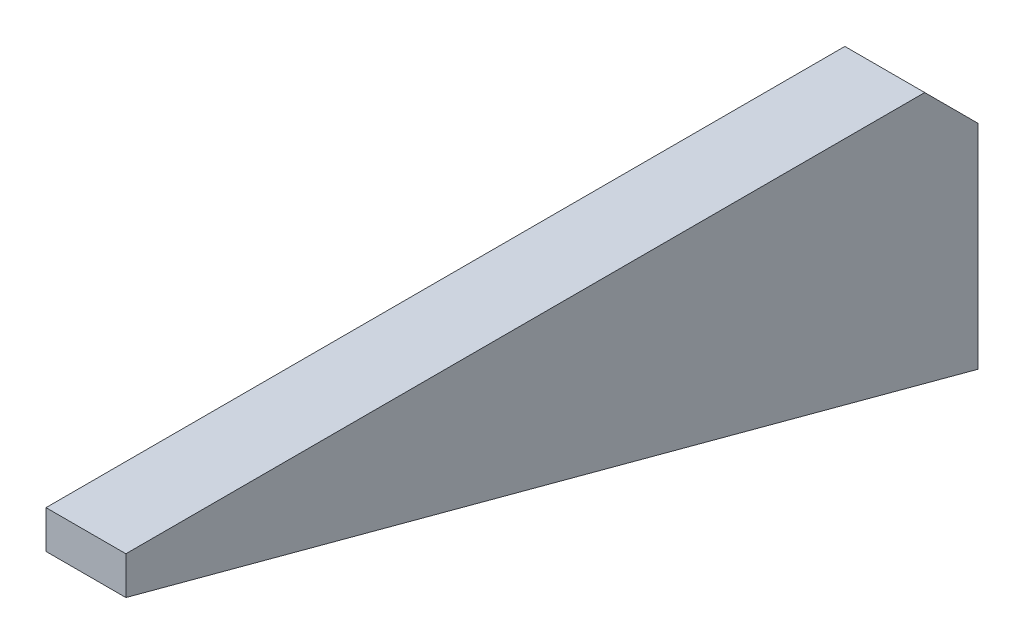
from build123d import *

# Parameters (mm, degrees)
BOSS_EXTRUDE1_DEPTH = 7.5
CHAMFER1_SIZE       = 10


with BuildPart() as part:
    # Sketch2 → Boss-Extrude1 (new, symmetric)
    with BuildSketch(Plane.YZ):
        Polygon((-50, 0), (0, 0), (0, 160), (-7.128129211, 160), align=None)
    extrude(amount=BOSS_EXTRUDE1_DEPTH, both=True)

    # Chamfer1
    chamfer1_edges = [part.edges().sort_by_distance(p)[0] for p in [
        (0, 0, 0),
    ]]
    chamfer(chamfer1_edges, length=CHAMFER1_SIZE)


solid = part.part
